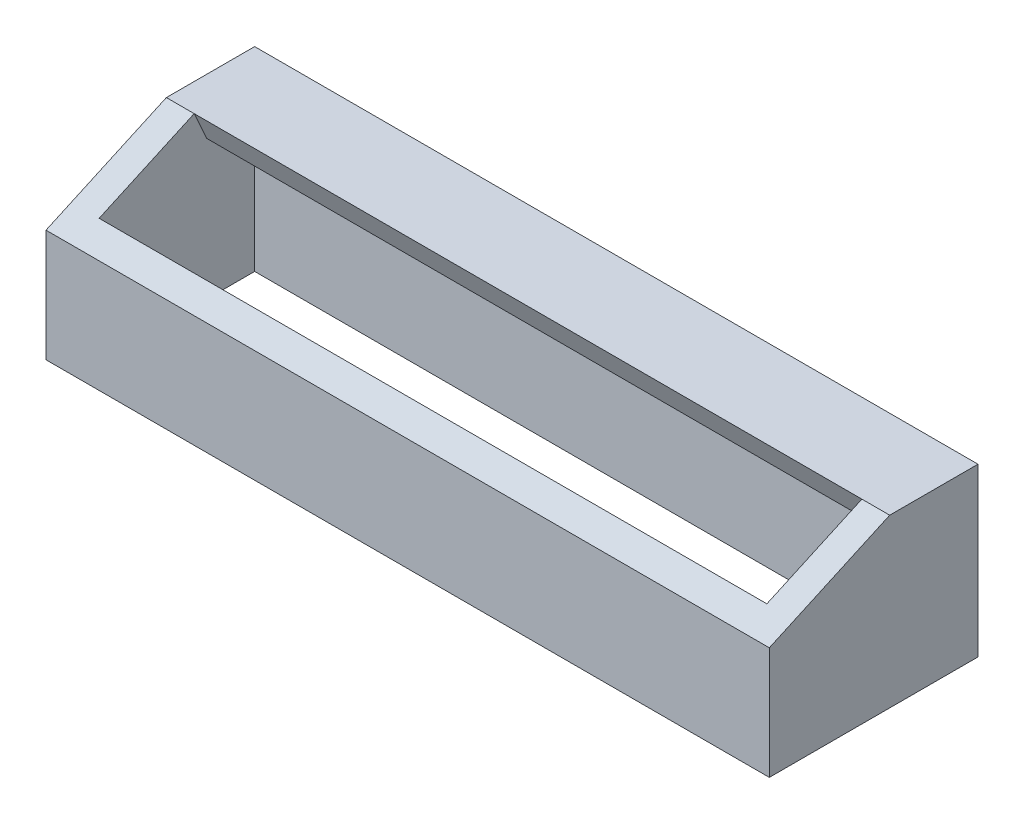
from build123d import *

# Parameters (mm, degrees)
SKETCH_1_W          = 520
SKETCH_1_H          = 150
EXTRUDE_1_DEPTH     = 80
SKETCH_3_W          = 520
SKETCH_3_H          = 150
EXTRUDE_2_DEPTH     = 40
CUT_EXTRUDE_1_DEPTH = 539.910938839
SKETCH_5_W          = 480
SKETCH_5_H          = 110
CUT_EXTRUDE_2_DEPTH = 70
SKETCH_7_W          = 480
SKETCH_7_H          = 55.028629816
CUT_EXTRUDE_3_DEPTH = 70
SKETCH_8_W          = 480
SKETCH_8_H          = 42.734816303
CUT_EXTRUDE_5_DEPTH = 30
SKETCH_9_W          = 480
SKETCH_9_H          = 45.831744101
CUT_EXTRUDE_6_DEPTH = 20
SKETCH_10_W         = 25
SKETCH_10_H         = 20
EXTRUDE_3_DEPTH     = 20
SKETCH_11_W         = 25
SKETCH_11_H         = 20
EXTRUDE_4_DEPTH     = 20


with BuildPart() as part:
    # 草圖1 → 填料-伸長1 (new body)
    with BuildSketch(Plane(origin=(0, 0, 0), x_dir=(1, 0, 0), z_dir=(0, 1, 0))):
        Rectangle(SKETCH_1_W, SKETCH_1_H)
    extrude(amount=EXTRUDE_1_DEPTH)

    # 草圖3 → 填料-伸長2 (add)
    with BuildSketch(Plane(origin=(0, 80, 0), x_dir=(1, 0, 0), z_dir=(0, 1, 0))):
        Rectangle(SKETCH_3_W, SKETCH_3_H)
    extrude(amount=EXTRUDE_2_DEPTH)

    # 草圖4 → 除料-伸長1 (cut, through all)
    with BuildSketch(Plane(origin=(260, 0, 0), x_dir=(0, 0, -1), z_dir=(1, 0, 0))):
        Polygon((-75, 80.706622888), (11.524395402, 120), (-75, 120), align=None)
    extrude(amount=-CUT_EXTRUDE_1_DEPTH, mode=Mode.SUBTRACT)

    # 草圖5 → 除料-伸長2 (cut)
    with BuildSketch(Plane(origin=(0, 0, 0), x_dir=(-1, 0, 0), z_dir=(0, -1, 0))):
        Rectangle(SKETCH_5_W, SKETCH_5_H)
    extrude(amount=-CUT_EXTRUDE_2_DEPTH, mode=Mode.SUBTRACT)

    # 草圖7 → 除料-伸長3 (cut)
    with BuildSketch(Plane(origin=(0, 95.144358744, 43.207966387), x_dir=(1, 0, 0), z_dir=(0, 0.9105087126935232, 0.4134898839260561))):
        with Locations((0, 12.597533586)):
            Rectangle(SKETCH_7_W, SKETCH_7_H)
    extrude(amount=-CUT_EXTRUDE_3_DEPTH, mode=Mode.SUBTRACT)

    # 草圖8 → 除料-伸長5 (cut)
    with BuildSketch(Plane.XZ.offset(-70)):
        with Locations((0, -33.632591848)):
            Rectangle(SKETCH_8_W, SKETCH_8_H)
    extrude(amount=-CUT_EXTRUDE_5_DEPTH, mode=Mode.SUBTRACT)

    # 草圖9 → 除料-伸長6 (cut)
    with BuildSketch(Plane(origin=(0, 16.585843578, -36.522187536), x_dir=(1, 0, 0), z_dir=(0, -0.4134898839260561, 0.9105087126935232))):
        with Locations((0, 81.579952556)):
            Rectangle(SKETCH_9_W, SKETCH_9_H)
    extrude(amount=-CUT_EXTRUDE_6_DEPTH, mode=Mode.SUBTRACT)

    # 草圖10 → 填料-伸長3 (add)
    with BuildSketch(Plane(origin=(0, 0, -85), x_dir=(-1, 0, 0), z_dir=(0, 0, -1))):
        with Locations((-187.5, 10)):
            Rectangle(SKETCH_10_W, SKETCH_10_H)
    extrude(amount=-EXTRUDE_3_DEPTH)

    # 草圖11 → 填料-伸長4 (add)
    with BuildSketch(Plane(origin=(0, 0, -85), x_dir=(-1, 0, 0), z_dir=(0, 0, -1))):
        with Locations((187.5, 10)):
            Rectangle(SKETCH_11_W, SKETCH_11_H)
    extrude(amount=-EXTRUDE_4_DEPTH)


solid = part.part
